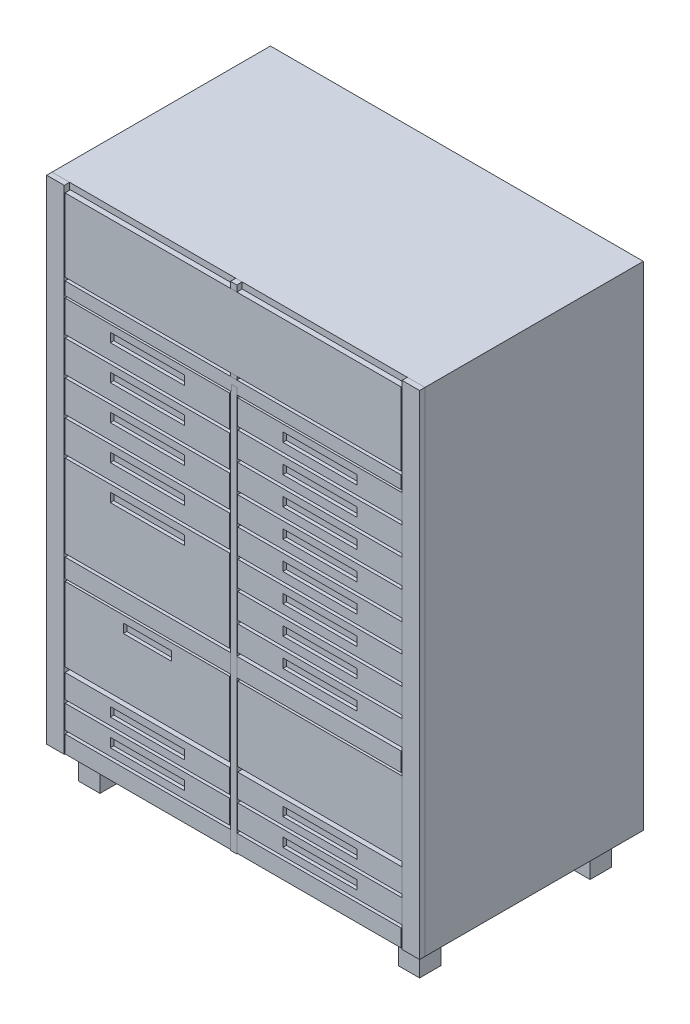
from build123d import *

# Parameters (mm, degrees)
SKETCH1_W                   = 1400
SKETCH1_H                   = 1850
GOVDE_KASA_DEPTH            = 820
SKETCH2_W                   = 80
SKETCH2_H                   = 80
AYAK_1_DEPTH                = 120
SKETCH3_W                   = 80
SKETCH3_H                   = 80
AYAK_2_DEPTH                = 120
SKETCH4_W                   = 80
SKETCH4_H                   = 80
AYAK_3_DEPTH                = 120
SKETCH5_W                   = 80
SKETCH5_H                   = 80
AYAK_4_DEPTH                = 120
SKETCH6_W                   = 66
SKETCH6_H                   = 1850
SOVE_SOL_DEPTH              = 20
SKETCH7_W                   = 24
SKETCH7_H                   = 1850
SOVE_ORTA_DEPTH             = 20
SKETCH8_W                   = 66
SKETCH8_H                   = 1850
SOVE_SAG_DEPTH              = 20
SKETCH9_W                   = 1262
SKETCH9_H                   = 274
PANEL_SOGUTMA_DEPTH         = 20
SKETCH10_W                  = 1262
SKETCH10_H                  = 48
PANEL_BANT_UST_DEPTH        = 20
SKETCH11_W                  = 618
SKETCH11_H                  = 118
CEKMECE_ICECEK_1_DEPTH      = 20
CEKMECE_ICECEK_1_KULP_START = 7
SKETCH12_W                  = 278.1
SKETCH12_H                  = 34
CEKMECE_ICECEK_1_KULP_DEPTH = 13
SKETCH13_W                  = 618
SKETCH13_H                  = 118
CEKMECE_ICECEK_2_DEPTH      = 20
CEKMECE_ICECEK_2_KULP_START = 7
SKETCH14_W                  = 278.1
SKETCH14_H                  = 34
CEKMECE_ICECEK_2_KULP_DEPTH = 13
SKETCH15_W                  = 618
SKETCH15_H                  = 118
CEKMECE_ICECEK_3_DEPTH      = 20
CEKMECE_ICECEK_3_KULP_START = 7
SKETCH16_W                  = 278.1
SKETCH16_H                  = 34
CEKMECE_ICECEK_3_KULP_DEPTH = 13
SKETCH17_W                  = 618
SKETCH17_H                  = 118
CEKMECE_ICECEK_4_DEPTH      = 20
CEKMECE_ICECEK_4_KULP_START = 7
SKETCH18_W                  = 278.1
SKETCH18_H                  = 34
CEKMECE_ICECEK_4_KULP_DEPTH = 13
SKETCH19_W                  = 618
SKETCH19_H                  = 310
CEKMECE_1L_DEPTH            = 20
CEKMECE_1L_KULP_START       = 7
SKETCH20_W                  = 278.1
SKETCH20_H                  = 34
CEKMECE_1L_KULP_DEPTH       = 13
SKETCH21_W                  = 618
SKETCH21_H                  = 93
CEKMECE_TAZE_1_DEPTH        = 20
CEKMECE_TAZE_1_KULP_START   = 7
SKETCH22_W                  = 278.1
SKETCH22_H                  = 34
CEKMECE_TAZE_1_KULP_DEPTH   = 13
SKETCH23_W                  = 618
SKETCH23_H                  = 93
CEKMECE_TAZE_2_DEPTH        = 20
CEKMECE_TAZE_2_KULP_START   = 7
SKETCH24_W                  = 278.1
SKETCH24_H                  = 34
CEKMECE_TAZE_2_KULP_DEPTH   = 13
SKETCH25_W                  = 618
SKETCH25_H                  = 93
CEKMECE_TAZE_3_DEPTH        = 20
CEKMECE_TAZE_3_KULP_START   = 7
SKETCH26_W                  = 278.1
SKETCH26_H                  = 34
CEKMECE_TAZE_3_KULP_DEPTH   = 13
SKETCH27_W                  = 618
SKETCH27_H                  = 93
CEKMECE_TAZE_4_DEPTH        = 20
CEKMECE_TAZE_4_KULP_START   = 7
SKETCH28_W                  = 278.1
SKETCH28_H                  = 34
CEKMECE_TAZE_4_KULP_DEPTH   = 13
SKETCH29_W                  = 618
SKETCH29_H                  = 93
CEKMECE_TAZE_5_DEPTH        = 20
CEKMECE_TAZE_5_KULP_START   = 7
SKETCH30_W                  = 278.1
SKETCH30_H                  = 34
CEKMECE_TAZE_5_KULP_DEPTH   = 13
SKETCH31_W                  = 618
SKETCH31_H                  = 93
CEKMECE_TAZE_6_DEPTH        = 20
CEKMECE_TAZE_6_KULP_START   = 7
SKETCH32_W                  = 278.1
SKETCH32_H                  = 34
CEKMECE_TAZE_6_KULP_DEPTH   = 13
SKETCH33_W                  = 618
SKETCH33_H                  = 93
CEKMECE_TAZE_7_DEPTH        = 20
CEKMECE_TAZE_7_KULP_START   = 7
SKETCH34_W                  = 278.1
SKETCH34_H                  = 34
CEKMECE_TAZE_7_KULP_DEPTH   = 13
SKETCH35_W                  = 618
SKETCH35_H                  = 93
CEKMECE_TAZE_8_DEPTH        = 20
CEKMECE_TAZE_8_KULP_START   = 7
SKETCH36_W                  = 278.1
SKETCH36_H                  = 34
CEKMECE_TAZE_8_KULP_DEPTH   = 13
SKETCH37_W                  = 1262
SKETCH37_H                  = 70
PANEL_AYIRICI_PU80_DEPTH    = 20
SKETCH38_W                  = 618
SKETCH38_H                  = 278
KLAPE_KASET_KATI_DEPTH      = 20
KLAPE_KASET_KATI_KULP_START = 7
SKETCH39_W                  = 180
SKETCH39_H                  = 34
KLAPE_KASET_KATI_KULP_DEPTH = 13
SKETCH40_W                  = 618
SKETCH40_H                  = 278
PANEL_BOS_BANT_DEPTH        = 20
SKETCH41_W                  = 618
SKETCH41_H                  = 88
CEKMECE_DONMUS_1_DEPTH      = 20
CEKMECE_DONMUS_1_KULP_START = 7
SKETCH42_W                  = 278.1
SKETCH42_H                  = 34
CEKMECE_DONMUS_1_KULP_DEPTH = 13
SKETCH43_W                  = 618
SKETCH43_H                  = 88
CEKMECE_DONMUS_2_DEPTH      = 20
CEKMECE_DONMUS_2_KULP_START = 7
SKETCH44_W                  = 278.1
SKETCH44_H                  = 34
CEKMECE_DONMUS_2_KULP_DEPTH = 13
SKETCH45_W                  = 618
SKETCH45_H                  = 88
CEKMECE_DONMUS_3_DEPTH      = 20
CEKMECE_DONMUS_3_KULP_START = 7
SKETCH46_W                  = 278.1
SKETCH46_H                  = 34
CEKMECE_DONMUS_3_KULP_DEPTH = 13
SKETCH47_W                  = 618
SKETCH47_H                  = 88
CEKMECE_DONMUS_4_DEPTH      = 20
CEKMECE_DONMUS_4_KULP_START = 7
SKETCH48_W                  = 278.1
SKETCH48_H                  = 34
CEKMECE_DONMUS_4_KULP_DEPTH = 13
SKETCH49_W                  = 1262
SKETCH49_H                  = 65
PANEL_BANT_ALT_DEPTH        = 20


with BuildPart() as part:
    # Sketch1 → govde_kasa (new body)
    with BuildSketch(Plane.XY):
        with Locations((700, 1045)):
            Rectangle(SKETCH1_W, SKETCH1_H)
    extrude(amount=-GOVDE_KASA_DEPTH)


with BuildPart() as body_2:
    # Sketch2 → ayak_1 (new body)
    with BuildSketch(Plane(origin=(0, 0, 0), x_dir=(1, 0, 0), z_dir=(0, 1, 0))):
        with Locations((100, 80)):
            Rectangle(SKETCH2_W, SKETCH2_H)
    extrude(amount=AYAK_1_DEPTH)


with BuildPart() as body_3:
    # Sketch3 → ayak_2 (new body)
    with BuildSketch(Plane(origin=(0, 0, 0), x_dir=(1, 0, 0), z_dir=(0, 1, 0))):
        with Locations((1300, 80)):
            Rectangle(SKETCH3_W, SKETCH3_H)
    extrude(amount=AYAK_2_DEPTH)


with BuildPart() as body_4:
    # Sketch4 → ayak_3 (new body)
    with BuildSketch(Plane(origin=(0, 0, 0), x_dir=(1, 0, 0), z_dir=(0, 1, 0))):
        with Locations((100, 720)):
            Rectangle(SKETCH4_W, SKETCH4_H)
    extrude(amount=AYAK_3_DEPTH)


with BuildPart() as body_5:
    # Sketch5 → ayak_4 (new body)
    with BuildSketch(Plane(origin=(0, 0, 0), x_dir=(1, 0, 0), z_dir=(0, 1, 0))):
        with Locations((1300, 720)):
            Rectangle(SKETCH5_W, SKETCH5_H)
    extrude(amount=AYAK_4_DEPTH)


with BuildPart() as body_6:
    # Sketch6 → sove_sol (new body)
    with BuildSketch(Plane.XY):
        with Locations((33, 1045)):
            Rectangle(SKETCH6_W, SKETCH6_H)
    extrude(amount=SOVE_SOL_DEPTH)


with BuildPart() as body_7:
    # Sketch7 → sove_orta (new body)
    with BuildSketch(Plane.XY):
        with Locations((702, 1045)):
            Rectangle(SKETCH7_W, SKETCH7_H)
    extrude(amount=SOVE_ORTA_DEPTH)


with BuildPart() as body_8:
    # Sketch8 → sove_sag (new body)
    with BuildSketch(Plane.XY):
        with Locations((1367, 1045)):
            Rectangle(SKETCH8_W, SKETCH8_H)
    extrude(amount=SOVE_SAG_DEPTH)


with BuildPart() as body_9:
    # Sketch9 → panel_sogutma (new body)
    with BuildSketch(Plane.XY):
        with Locations((700, 1810)):
            Rectangle(SKETCH9_W, SKETCH9_H)
    extrude(amount=PANEL_SOGUTMA_DEPTH)


with BuildPart() as body_10:
    # Sketch10 → panel_bant_ust (new body)
    with BuildSketch(Plane.XY):
        with Locations((700, 1637)):
            Rectangle(SKETCH10_W, SKETCH10_H)
    extrude(amount=PANEL_BANT_UST_DEPTH)


with BuildPart() as body_11:
    # Sketch11 → cekmece_icecek_1 (new body)
    with BuildSketch(Plane.XY):
        with Locations((378, 1546)):
            Rectangle(SKETCH11_W, SKETCH11_H)
    extrude(amount=CEKMECE_ICECEK_1_DEPTH)

    # Sketch12 → cekmece_icecek_1_kulp (cut)
    with BuildSketch(Plane.XY.offset(CEKMECE_ICECEK_1_KULP_START)):
        with Locations((378, 1562)):
            Rectangle(SKETCH12_W, SKETCH12_H)
    extrude(amount=CEKMECE_ICECEK_1_KULP_DEPTH, mode=Mode.SUBTRACT)


with BuildPart() as body_12:
    # Sketch13 → cekmece_icecek_2 (new body)
    with BuildSketch(Plane.XY):
        with Locations((378, 1416)):
            Rectangle(SKETCH13_W, SKETCH13_H)
    extrude(amount=CEKMECE_ICECEK_2_DEPTH)

    # Sketch14 → cekmece_icecek_2_kulp (cut)
    with BuildSketch(Plane.XY.offset(CEKMECE_ICECEK_2_KULP_START)):
        with Locations((378, 1432)):
            Rectangle(SKETCH14_W, SKETCH14_H)
    extrude(amount=CEKMECE_ICECEK_2_KULP_DEPTH, mode=Mode.SUBTRACT)


with BuildPart() as body_13:
    # Sketch15 → cekmece_icecek_3 (new body)
    with BuildSketch(Plane.XY):
        with Locations((378, 1286)):
            Rectangle(SKETCH15_W, SKETCH15_H)
    extrude(amount=CEKMECE_ICECEK_3_DEPTH)

    # Sketch16 → cekmece_icecek_3_kulp (cut)
    with BuildSketch(Plane.XY.offset(CEKMECE_ICECEK_3_KULP_START)):
        with Locations((378, 1302)):
            Rectangle(SKETCH16_W, SKETCH16_H)
    extrude(amount=CEKMECE_ICECEK_3_KULP_DEPTH, mode=Mode.SUBTRACT)


with BuildPart() as body_14:
    # Sketch17 → cekmece_icecek_4 (new body)
    with BuildSketch(Plane.XY):
        with Locations((378, 1156)):
            Rectangle(SKETCH17_W, SKETCH17_H)
    extrude(amount=CEKMECE_ICECEK_4_DEPTH)

    # Sketch18 → cekmece_icecek_4_kulp (cut)
    with BuildSketch(Plane.XY.offset(CEKMECE_ICECEK_4_KULP_START)):
        with Locations((378, 1172)):
            Rectangle(SKETCH18_W, SKETCH18_H)
    extrude(amount=CEKMECE_ICECEK_4_KULP_DEPTH, mode=Mode.SUBTRACT)


with BuildPart() as body_15:
    # Sketch19 → cekmece_1L (new body)
    with BuildSketch(Plane.XY):
        with Locations((378, 930)):
            Rectangle(SKETCH19_W, SKETCH19_H)
    extrude(amount=CEKMECE_1L_DEPTH)

    # Sketch20 → cekmece_1L_kulp (cut)
    with BuildSketch(Plane.XY.offset(CEKMECE_1L_KULP_START)):
        with Locations((378, 1042)):
            Rectangle(SKETCH20_W, SKETCH20_H)
    extrude(amount=CEKMECE_1L_KULP_DEPTH, mode=Mode.SUBTRACT)


with BuildPart() as body_16:
    # Sketch21 → cekmece_taze_1 (new body)
    with BuildSketch(Plane.XY):
        with Locations((1026, 1558.5)):
            Rectangle(SKETCH21_W, SKETCH21_H)
    extrude(amount=CEKMECE_TAZE_1_DEPTH)

    # Sketch22 → cekmece_taze_1_kulp (cut)
    with BuildSketch(Plane.XY.offset(CEKMECE_TAZE_1_KULP_START)):
        with Locations((1026, 1562)):
            Rectangle(SKETCH22_W, SKETCH22_H)
    extrude(amount=CEKMECE_TAZE_1_KULP_DEPTH, mode=Mode.SUBTRACT)


with BuildPart() as body_17:
    # Sketch23 → cekmece_taze_2 (new body)
    with BuildSketch(Plane.XY):
        with Locations((1026, 1453.5)):
            Rectangle(SKETCH23_W, SKETCH23_H)
    extrude(amount=CEKMECE_TAZE_2_DEPTH)

    # Sketch24 → cekmece_taze_2_kulp (cut)
    with BuildSketch(Plane.XY.offset(CEKMECE_TAZE_2_KULP_START)):
        with Locations((1026, 1457)):
            Rectangle(SKETCH24_W, SKETCH24_H)
    extrude(amount=CEKMECE_TAZE_2_KULP_DEPTH, mode=Mode.SUBTRACT)


with BuildPart() as body_18:
    # Sketch25 → cekmece_taze_3 (new body)
    with BuildSketch(Plane.XY):
        with Locations((1026, 1348.5)):
            Rectangle(SKETCH25_W, SKETCH25_H)
    extrude(amount=CEKMECE_TAZE_3_DEPTH)

    # Sketch26 → cekmece_taze_3_kulp (cut)
    with BuildSketch(Plane.XY.offset(CEKMECE_TAZE_3_KULP_START)):
        with Locations((1026, 1352)):
            Rectangle(SKETCH26_W, SKETCH26_H)
    extrude(amount=CEKMECE_TAZE_3_KULP_DEPTH, mode=Mode.SUBTRACT)


with BuildPart() as body_19:
    # Sketch27 → cekmece_taze_4 (new body)
    with BuildSketch(Plane.XY):
        with Locations((1026, 1243.5)):
            Rectangle(SKETCH27_W, SKETCH27_H)
    extrude(amount=CEKMECE_TAZE_4_DEPTH)

    # Sketch28 → cekmece_taze_4_kulp (cut)
    with BuildSketch(Plane.XY.offset(CEKMECE_TAZE_4_KULP_START)):
        with Locations((1026, 1247)):
            Rectangle(SKETCH28_W, SKETCH28_H)
    extrude(amount=CEKMECE_TAZE_4_KULP_DEPTH, mode=Mode.SUBTRACT)


with BuildPart() as body_20:
    # Sketch29 → cekmece_taze_5 (new body)
    with BuildSketch(Plane.XY):
        with Locations((1026, 1138.5)):
            Rectangle(SKETCH29_W, SKETCH29_H)
    extrude(amount=CEKMECE_TAZE_5_DEPTH)

    # Sketch30 → cekmece_taze_5_kulp (cut)
    with BuildSketch(Plane.XY.offset(CEKMECE_TAZE_5_KULP_START)):
        with Locations((1026, 1142)):
            Rectangle(SKETCH30_W, SKETCH30_H)
    extrude(amount=CEKMECE_TAZE_5_KULP_DEPTH, mode=Mode.SUBTRACT)


with BuildPart() as body_21:
    # Sketch31 → cekmece_taze_6 (new body)
    with BuildSketch(Plane.XY):
        with Locations((1026, 1033.5)):
            Rectangle(SKETCH31_W, SKETCH31_H)
    extrude(amount=CEKMECE_TAZE_6_DEPTH)

    # Sketch32 → cekmece_taze_6_kulp (cut)
    with BuildSketch(Plane.XY.offset(CEKMECE_TAZE_6_KULP_START)):
        with Locations((1026, 1037)):
            Rectangle(SKETCH32_W, SKETCH32_H)
    extrude(amount=CEKMECE_TAZE_6_KULP_DEPTH, mode=Mode.SUBTRACT)


with BuildPart() as body_22:
    # Sketch33 → cekmece_taze_7 (new body)
    with BuildSketch(Plane.XY):
        with Locations((1026, 928.5)):
            Rectangle(SKETCH33_W, SKETCH33_H)
    extrude(amount=CEKMECE_TAZE_7_DEPTH)

    # Sketch34 → cekmece_taze_7_kulp (cut)
    with BuildSketch(Plane.XY.offset(CEKMECE_TAZE_7_KULP_START)):
        with Locations((1026, 932)):
            Rectangle(SKETCH34_W, SKETCH34_H)
    extrude(amount=CEKMECE_TAZE_7_KULP_DEPTH, mode=Mode.SUBTRACT)


with BuildPart() as body_23:
    # Sketch35 → cekmece_taze_8 (new body)
    with BuildSketch(Plane.XY):
        with Locations((1026, 823.5)):
            Rectangle(SKETCH35_W, SKETCH35_H)
    extrude(amount=CEKMECE_TAZE_8_DEPTH)

    # Sketch36 → cekmece_taze_8_kulp (cut)
    with BuildSketch(Plane.XY.offset(CEKMECE_TAZE_8_KULP_START)):
        with Locations((1026, 827)):
            Rectangle(SKETCH36_W, SKETCH36_H)
    extrude(amount=CEKMECE_TAZE_8_KULP_DEPTH, mode=Mode.SUBTRACT)


with BuildPart() as body_24:
    # Sketch37 → panel_ayirici_PU80 (new body)
    with BuildSketch(Plane.XY):
        with Locations((700, 728)):
            Rectangle(SKETCH37_W, SKETCH37_H)
    extrude(amount=PANEL_AYIRICI_PU80_DEPTH)


with BuildPart() as body_25:
    # Sketch38 → klape_kaset_kati (new body)
    with BuildSketch(Plane.XY):
        with Locations((378, 545)):
            Rectangle(SKETCH38_W, SKETCH38_H)
    extrude(amount=KLAPE_KASET_KATI_DEPTH)

    # Sketch39 → klape_kaset_kati_kulp (cut)
    with BuildSketch(Plane.XY.offset(KLAPE_KASET_KATI_KULP_START)):
        with Locations((378, 641)):
            Rectangle(SKETCH39_W, SKETCH39_H)
    extrude(amount=KLAPE_KASET_KATI_KULP_DEPTH, mode=Mode.SUBTRACT)


with BuildPart() as body_26:
    # Sketch40 → panel_bos_bant (new body)
    with BuildSketch(Plane.XY):
        with Locations((1026, 545)):
            Rectangle(SKETCH40_W, SKETCH40_H)
    extrude(amount=PANEL_BOS_BANT_DEPTH)


with BuildPart() as body_27:
    # Sketch41 → cekmece_donmus_1 (new body)
    with BuildSketch(Plane.XY):
        with Locations((378, 344)):
            Rectangle(SKETCH41_W, SKETCH41_H)
    extrude(amount=CEKMECE_DONMUS_1_DEPTH)

    # Sketch42 → cekmece_donmus_1_kulp (cut)
    with BuildSketch(Plane.XY.offset(CEKMECE_DONMUS_1_KULP_START)):
        with Locations((378, 345)):
            Rectangle(SKETCH42_W, SKETCH42_H)
    extrude(amount=CEKMECE_DONMUS_1_KULP_DEPTH, mode=Mode.SUBTRACT)


with BuildPart() as body_28:
    # Sketch43 → cekmece_donmus_2 (new body)
    with BuildSketch(Plane.XY):
        with Locations((378, 244)):
            Rectangle(SKETCH43_W, SKETCH43_H)
    extrude(amount=CEKMECE_DONMUS_2_DEPTH)

    # Sketch44 → cekmece_donmus_2_kulp (cut)
    with BuildSketch(Plane.XY.offset(CEKMECE_DONMUS_2_KULP_START)):
        with Locations((378, 245)):
            Rectangle(SKETCH44_W, SKETCH44_H)
    extrude(amount=CEKMECE_DONMUS_2_KULP_DEPTH, mode=Mode.SUBTRACT)


with BuildPart() as body_29:
    # Sketch45 → cekmece_donmus_3 (new body)
    with BuildSketch(Plane.XY):
        with Locations((1026, 344)):
            Rectangle(SKETCH45_W, SKETCH45_H)
    extrude(amount=CEKMECE_DONMUS_3_DEPTH)

    # Sketch46 → cekmece_donmus_3_kulp (cut)
    with BuildSketch(Plane.XY.offset(CEKMECE_DONMUS_3_KULP_START)):
        with Locations((1026, 345)):
            Rectangle(SKETCH46_W, SKETCH46_H)
    extrude(amount=CEKMECE_DONMUS_3_KULP_DEPTH, mode=Mode.SUBTRACT)


with BuildPart() as body_30:
    # Sketch47 → cekmece_donmus_4 (new body)
    with BuildSketch(Plane.XY):
        with Locations((1026, 244)):
            Rectangle(SKETCH47_W, SKETCH47_H)
    extrude(amount=CEKMECE_DONMUS_4_DEPTH)

    # Sketch48 → cekmece_donmus_4_kulp (cut)
    with BuildSketch(Plane.XY.offset(CEKMECE_DONMUS_4_KULP_START)):
        with Locations((1026, 245)):
            Rectangle(SKETCH48_W, SKETCH48_H)
    extrude(amount=CEKMECE_DONMUS_4_KULP_DEPTH, mode=Mode.SUBTRACT)


with BuildPart() as body_31:
    # Sketch49 → panel_bant_alt (new body)
    with BuildSketch(Plane.XY):
        with Locations((700, 155.5)):
            Rectangle(SKETCH49_W, SKETCH49_H)
    extrude(amount=PANEL_BANT_ALT_DEPTH)


solid = Compound([part.part, body_2.part, body_3.part, body_4.part, body_5.part, body_6.part, body_7.part, body_8.part, body_9.part, body_10.part, body_11.part, body_12.part, body_13.part, body_14.part, body_15.part, body_16.part, body_17.part, body_18.part, body_19.part, body_20.part, body_21.part, body_22.part, body_23.part, body_24.part, body_25.part, body_26.part, body_27.part, body_28.part, body_29.part, body_30.part, body_31.part])
